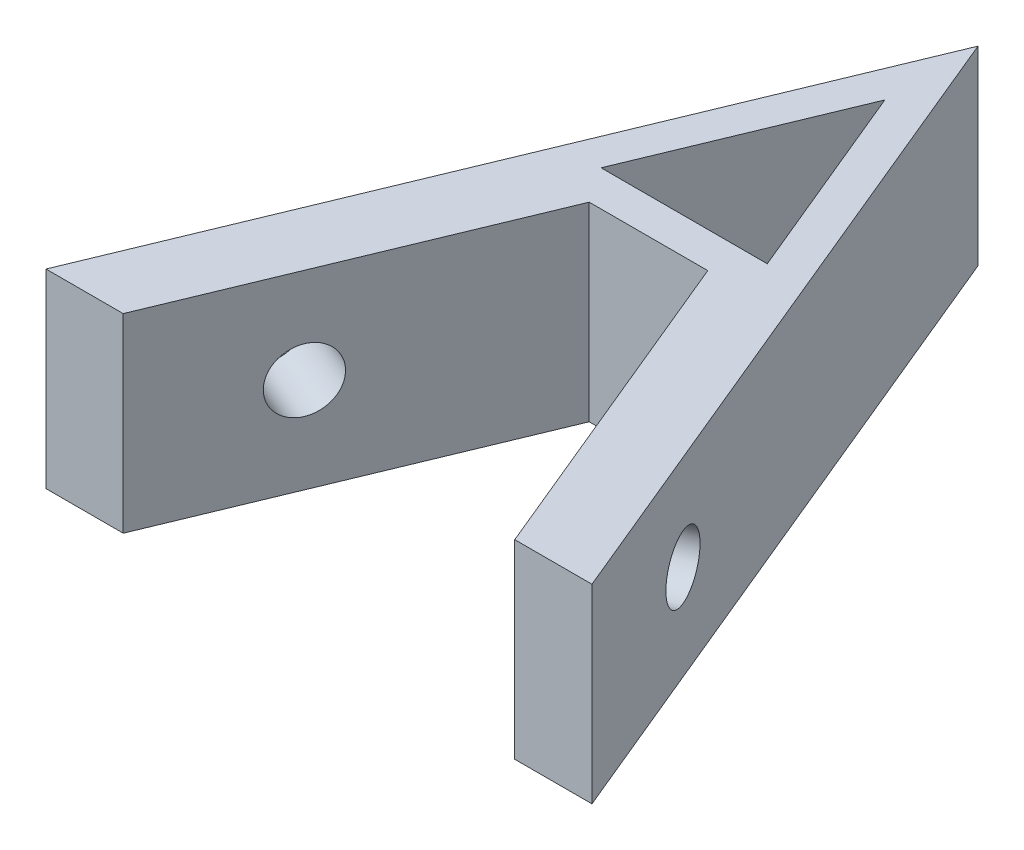
from build123d import *

# Parameters (mm, degrees)
BOSS_EXTRUDE1_DEPTH = 16
CUT_EXTRUDE1_DEPTH  = 16
SKETCH3_R           = 2.65
CUT_EXTRUDE2_DEPTH  = 16
SKETCH4_R           = 2.65
CUT_EXTRUDE3_DEPTH  = 16


with BuildPart() as part:
    # Sketch1 → Boss-Extrude1 (new body)
    with BuildSketch(Plane(origin=(0, 0, 0), x_dir=(1, 0, 0), z_dir=(0, 1, 0))):
        Polygon((0, 0), (-22.961005942, -55.432771951), (22.961005942, -55.432771951), align=None)
    extrude(amount=BOSS_EXTRUDE1_DEPTH)

    # Sketch2 → Cut-Extrude1 (cut)
    with BuildSketch(Plane(origin=(0, 16, 0), x_dir=(1, 0, 0), z_dir=(0, 1, 0))):
        Polygon((-16.46665274, -55.432771951), (-4.986149769, -27.716385975), (4.986149769, -27.716385975), (16.46665274, -55.432771951), align=None)
        Polygon((-6.990685683, -24.716385975), (6.990685683, -24.716385975), (0, -7.839377789), align=None)
    extrude(amount=-CUT_EXTRUDE1_DEPTH, mode=Mode.SUBTRACT)

    # Sketch3 → Cut-Extrude2 (cut)
    with BuildSketch(Plane(origin=(0, 0, 0), x_dir=(-0.3826834323650873, 0, -0.9238795325112878), z_dir=(0.9238795325112878, 0, -0.3826834323650873))):
        with Locations((-45.85, 8)):
            Circle(SKETCH3_R)
    extrude(amount=-CUT_EXTRUDE2_DEPTH, mode=Mode.SUBTRACT)

    # Sketch4 → Cut-Extrude3 (cut)
    with BuildSketch(Plane(origin=(0, 0, 0), x_dir=(-0.3826834323650873, 0, 0.9238795325112878), z_dir=(-0.9238795325112878, 0, -0.3826834323650873))):
        with Locations((45.85, 8)):
            Circle(SKETCH4_R)
    extrude(amount=-CUT_EXTRUDE3_DEPTH, mode=Mode.SUBTRACT)


solid = part.part
